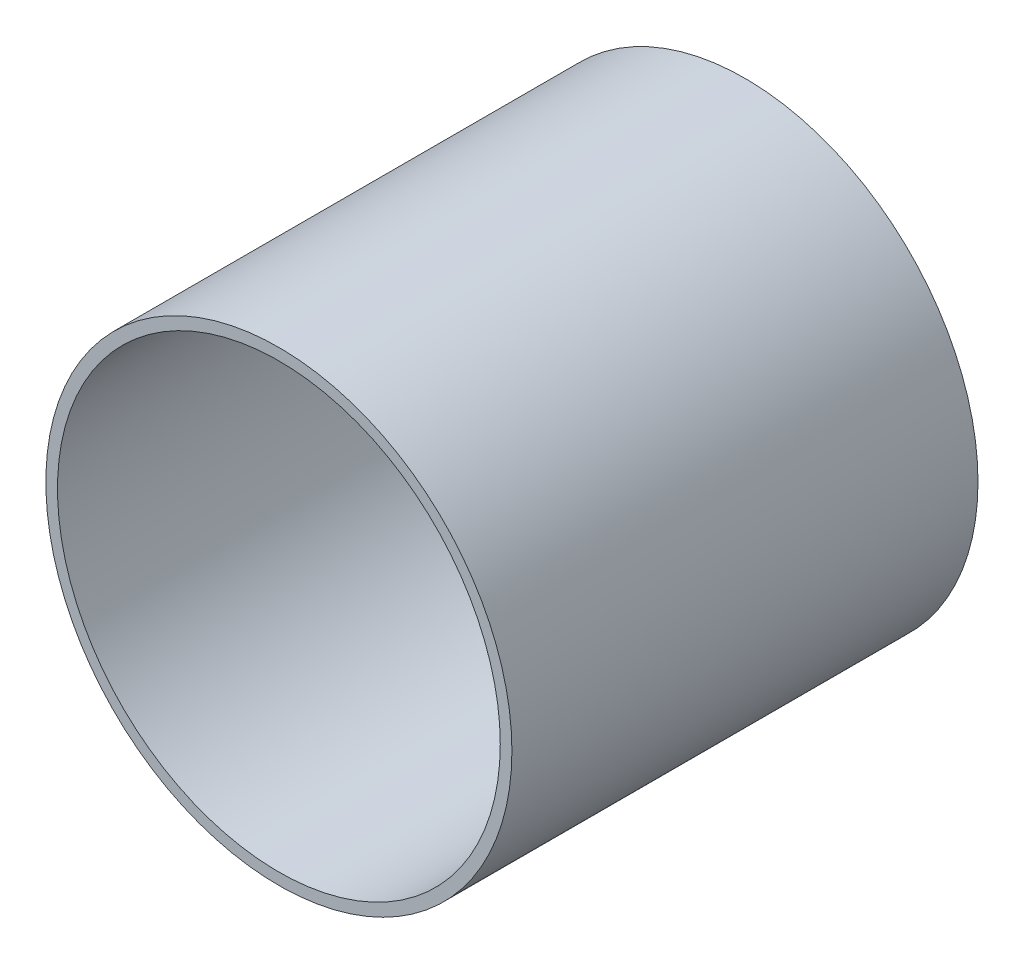
from build123d import *

# Parameters (mm, degrees)
SKETCH_2_R          = 100
EXTRUDE_2_DEPTH     = 200
SKETCH_3_R          = 95
CUT_EXTRUDE_1_DEPTH = 400
SKETCH_4_R          = 80
EXTRUDE_3_DEPTH     = 30


with BuildPart() as part:
    # 草图2 → 凸台-拉伸2 (new body)
    with BuildSketch(Plane.XY):
        Circle(SKETCH_2_R)
    extrude(amount=EXTRUDE_2_DEPTH)

    # 草图3 → 切除-拉伸1 (cut)
    with BuildSketch(Plane.XY.offset(200)):
        Circle(SKETCH_3_R)
    extrude(amount=-CUT_EXTRUDE_1_DEPTH, mode=Mode.SUBTRACT)


with BuildPart() as body_2:
    # 草图4 → 凸台-拉伸3 (new body)
    with BuildSketch(Plane(origin=(0, 0, 0), x_dir=(-1, 0, 0), z_dir=(0, 0, -1))):
        Circle(SKETCH_4_R)
    extrude(amount=-EXTRUDE_3_DEPTH)


solid = Compound([part.part, body_2.part])
